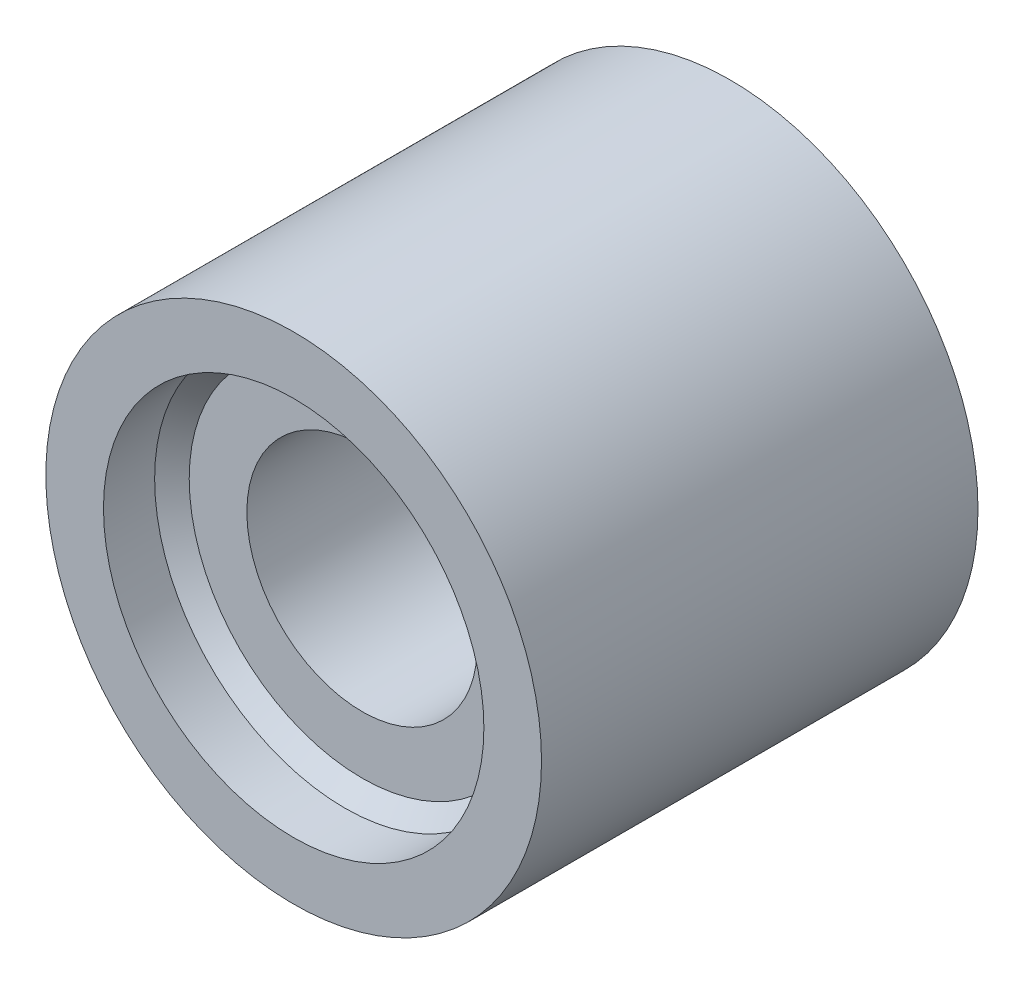
from build123d import *

# Parameters (mm, degrees)
SKETCH1_R           = 10.922
SKETCH1_R_2         = 8.382
BOSS_EXTRUDE1_DEPTH = 9.61771
SKETCH1_3_R         = 8.382
SKETCH1_3_R_2       = 5.08
BOSS_EXTRUDE2_DEPTH = 6.60146
CHAMFER1_SIZE       = 0.762


with BuildPart() as part:
    # Sketch1 → Boss-Extrude1 (new, symmetric)
    with BuildSketch(Plane.XY):
        Circle(SKETCH1_R)
        Circle(SKETCH1_R_2, mode=Mode.SUBTRACT)
    extrude(amount=BOSS_EXTRUDE1_DEPTH, both=True)

    # Sketch1<3> → Boss-Extrude2 (add, symmetric)
    with BuildSketch(Plane.XY):
        Circle(SKETCH1_3_R)
        Circle(SKETCH1_3_R_2, mode=Mode.SUBTRACT)
    extrude(amount=BOSS_EXTRUDE2_DEPTH, both=True)

    # Chamfer1
    chamfer1_edges = [part.edges().sort_by_distance(p)[0] for p in [
        (-8.382, 0, -6.60146),
        (-8.382, 0, 6.60146),
    ]]
    chamfer(chamfer1_edges, length=CHAMFER1_SIZE)


solid = part.part
